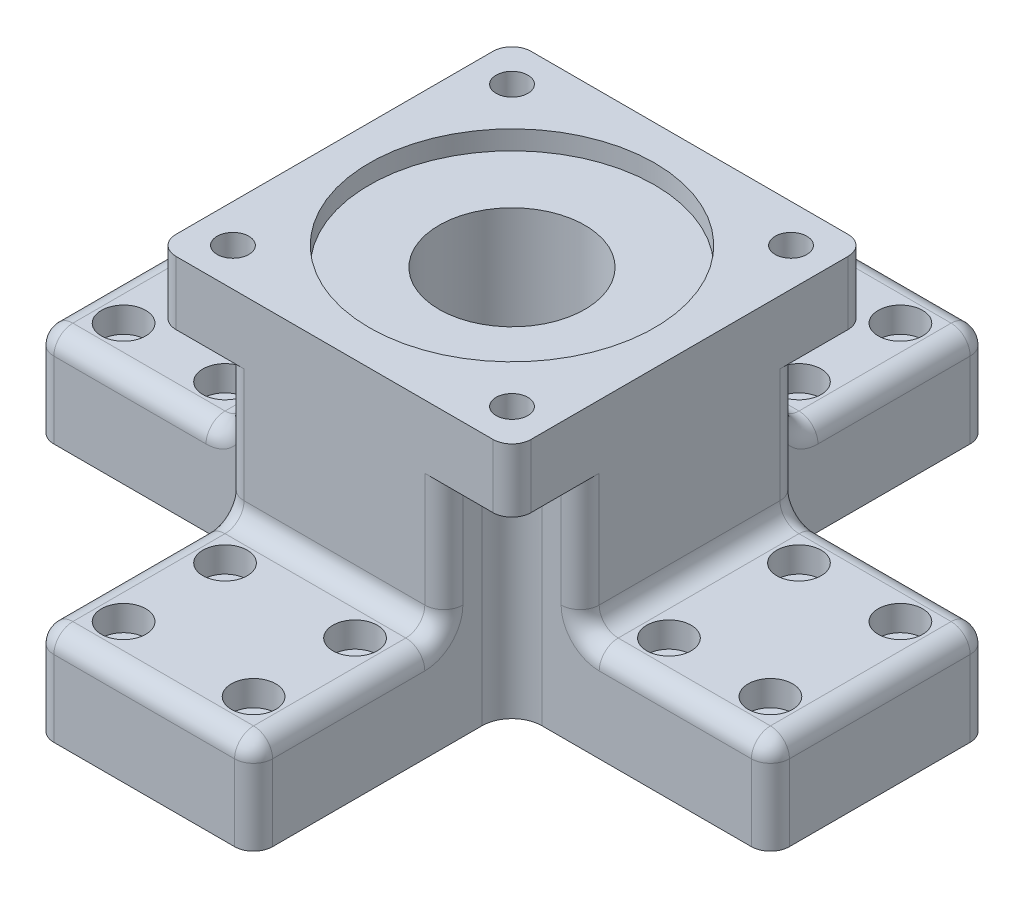
from build123d import *

# Parameters (mm, degrees)
SKETCH1_W           = 56
SKETCH1_H           = 56
BOSS_EXTRUDE1_DEPTH = 46
SKETCH2_R           = 22.5
CUT_EXTRUDE1_DEPTH  = 3
SKETCH3_R           = 11.5
CUT_EXTRUDE2_DEPTH  = 50
SKETCH4_R           = 2.5
CUT_EXTRUDE3_DEPTH  = 10
CUT_EXTRUDE4_DEPTH  = 36
SKETCH6_W           = 34.5
SKETCH6_H           = 15
BOSS_EXTRUDE2_DEPTH = 30
SKETCH7_R           = 2.15
CUT_EXTRUDE5_DEPTH  = 30
FILLET1_R           = 3
SKETCH8_R           = 3.5
CUT_EXTRUDE6_DEPTH  = 4
CIRPATTERN2_COUNT   = 4
FILLET2_R           = 3
FILLET3_R           = 3
FILLET4_R           = 3
FILLET5_R           = 3


with BuildPart() as part:
    # Sketch1 → Boss-Extrude1 (new body)
    with BuildSketch(Plane(origin=(0, 0, 0), x_dir=(1, 0, 0), z_dir=(0, 1, 0))):
        Rectangle(SKETCH1_W, SKETCH1_H)
    extrude(amount=BOSS_EXTRUDE1_DEPTH)

    # Sketch2 → Cut-Extrude1 (cut)
    with BuildSketch(Plane(origin=(0, 46, 0), x_dir=(1, 0, 0), z_dir=(0, 1, 0))):
        with Locations(Location((0, 0, 0), (0, 0, 270))):
            Circle(SKETCH2_R)
    extrude(amount=-CUT_EXTRUDE1_DEPTH, mode=Mode.SUBTRACT)

    # Sketch3 → Cut-Extrude2 (cut)
    with BuildSketch(Plane(origin=(0, 43, 0), x_dir=(1, 0, 0), z_dir=(0, 1, 0))):
        with Locations(Location((0, 0, 0), (0, 0, 270))):
            Circle(SKETCH3_R)
    extrude(amount=-CUT_EXTRUDE2_DEPTH, mode=Mode.SUBTRACT)

    # Sketch4 → Cut-Extrude3 (cut)
    with BuildSketch(Plane(origin=(0, 46, 0), x_dir=(1, 0, 0), z_dir=(0, 1, 0))):
        with Locations(Location((-22, 22, 0), (0, 0, 270))):
            Circle(SKETCH4_R)
        with Locations(Location((22, 22, 0), (0, 0, 90))):
            Circle(SKETCH4_R)
        with Locations(Location((22, -22, 0), (0, 0, 270))):
            Circle(SKETCH4_R)
        with Locations(Location((-22, -22, 0), (0, 0, 90))):
            Circle(SKETCH4_R)
    extrude(amount=-CUT_EXTRUDE3_DEPTH, mode=Mode.SUBTRACT)

    # Sketch5 → Cut-Extrude4 (cut)
    with BuildSketch(Plane.XZ):
        with BuildLine():
            Line((-22, 17.25), (-28, 17.25))
            Line((-28, 17.25), (-28, 28))
            Line((-28, 28), (-17.25, 28))
            Line((-17.25, 28), (-17.25, 22))
            ThreePointArc((-17.25, 22), (-18.641242789, 18.641242789), (-22, 17.25))
        make_face()
        with BuildLine():
            Line((17.25, 22), (17.25, 28))
            Line((17.25, 28), (28, 28))
            Line((28, 28), (28, 17.25))
            Line((28, 17.25), (22, 17.25))
            ThreePointArc((22, 17.25), (18.641242789, 18.641242789), (17.25, 22))
        make_face()
        with BuildLine():
            Line((-28, -17.25), (-28, -28))
            Line((-28, -28), (-17.25, -28))
            Line((-17.25, -28), (-17.25, -22))
            ThreePointArc((-17.25, -22), (-18.641242789, -18.641242789), (-22, -17.25))
            Line((-22, -17.25), (-28, -17.25))
        make_face()
        with BuildLine():
            Line((22, -17.25), (28, -17.25))
            Line((28, -17.25), (28, -28))
            Line((28, -28), (17.25, -28))
            Line((17.25, -28), (17.25, -22))
            ThreePointArc((17.25, -22), (18.641242789, -18.641242789), (22, -17.25))
        make_face()
    extrude(amount=-CUT_EXTRUDE4_DEPTH, mode=Mode.SUBTRACT)

    # Sketch6 → Boss-Extrude2 (add)
    with BuildSketch(Plane(origin=(0, 0, -28), x_dir=(-1, 0, 0), z_dir=(0, 0, -1))):
        with Locations((0, 7.5)):
            Rectangle(SKETCH6_W, SKETCH6_H)
    boss_extrude2 = extrude(amount=BOSS_EXTRUDE2_DEPTH)

    # Sketch7 → Cut-Extrude5 (cut)
    with BuildSketch(Plane(origin=(0, 15, 0), x_dir=(1, 0, 0), z_dir=(0, 1, 0))):
        with Locations(Location((-10.25, 51, 0), (0, 0, 270))):
            Circle(SKETCH7_R)
        with Locations(Location((10.25, 51, 0), (0, 0, 90))):
            Circle(SKETCH7_R)
        with Locations(Location((10.25, 35, 0), (0, 0, 270))):
            Circle(SKETCH7_R)
        with Locations(Location((-10.25, 35, 0), (0, 0, 90))):
            Circle(SKETCH7_R)
    cut_extrude5 = extrude(amount=-CUT_EXTRUDE5_DEPTH, mode=Mode.SUBTRACT)

    # Fillet1
    fillet1_edges = [part.edges().sort_by_distance(p)[0] for p in [
        (0, 15, -28),
    ]]
    fillet(fillet1_edges, radius=FILLET1_R)

    # Sketch8 → Cut-Extrude6 (cut)
    with BuildSketch(Plane(origin=(0, 15, 0), x_dir=(1, 0, 0), z_dir=(0, 1, 0))):
        with Locations(Location((-10.25, 51, 0), (0, 0, 270))):
            Circle(SKETCH8_R)
        with Locations(Location((10.25, 51, 0), (0, 0, 270))):
            Circle(SKETCH8_R)
        with Locations(Location((-10.25, 35, 0), (0, 0, 270))):
            Circle(SKETCH8_R)
        with Locations(Location((10.25, 35, 0), (0, 0, 270))):
            Circle(SKETCH8_R)
    cut_extrude6 = extrude(amount=-CUT_EXTRUDE6_DEPTH, mode=Mode.SUBTRACT)

    # CirPattern2: Boss-Extrude2, Cut-Extrude5, Cut-Extrude6 ×4 about axis
    cirpattern2_axis = Axis((0, 0, 0), (0, 1, 0))
    add([boss_extrude2.rotate(cirpattern2_axis, i * 360 / CIRPATTERN2_COUNT) for i in range(1, CIRPATTERN2_COUNT)])
    add([cut_extrude5.rotate(cirpattern2_axis, i * 360 / CIRPATTERN2_COUNT) for i in range(1, CIRPATTERN2_COUNT)], mode=Mode.SUBTRACT)
    add([cut_extrude6.rotate(cirpattern2_axis, i * 360 / CIRPATTERN2_COUNT) for i in range(1, CIRPATTERN2_COUNT)], mode=Mode.SUBTRACT)

    # Fillet2
    fillet2_edges = [part.edges().sort_by_distance(p)[0] for p in [
        (-28, 15, 0),
        (0, 15, 28),
        (28, 15, 0),
    ]]
    fillet(fillet2_edges, radius=FILLET2_R)

    # Fillet3
    fillet3_edges = [part.edges().sort_by_distance(p)[0] for p in [
        (17.25, 7.5, -58),
        (-17.25, 7.5, -58),
        (-58, 7.5, -17.25),
        (-58, 7.5, 17.25),
        (-17.25, 7.5, 58),
        (17.25, 7.5, 58),
        (58, 7.5, 17.25),
        (58, 7.5, -17.25),
    ]]
    fillet(fillet3_edges, radius=FILLET3_R)

    # Fillet4
    fillet4_edges = [part.edges().sort_by_distance(p)[0] for p in [
        (17.25, 15.878679656, -28.878679656),
        (-17.25, 15.878679656, -28.878679656),
        (28.878679656, 15.878679656, 17.25),
        (28.878679656, 15.878679656, -17.25),
        (-28.878679656, 15.878679656, -17.25),
        (-28.878679656, 15.878679656, 17.25),
        (0, 15, -58),
        (17.25, 15, -43),
        (-17.25, 15, -43),
        (-16.371320344, 15, -57.121320344),
        (16.371320344, 15, -57.121320344),
        (58, 15, 0),
        (43, 15, -17.25),
        (43, 15, 17.25),
        (57.121320344, 15, 16.371320344),
        (57.121320344, 15, -16.371320344),
        (-58, 15, 0),
        (-43, 15, 17.25),
        (-43, 15, -17.25),
        (-57.121320344, 15, -16.371320344),
        (-57.121320344, 15, 16.371320344),
        (28, 27, 17.25),
        (-28, 27, -17.25),
        (-17.25, 27, -28),
        (28, 27, -17.25),
        (17.25, 27, -28),
        (28, 41, 28),
        (-28, 41, 28),
        (-28, 41, -28),
        (28, 41, -28),
        (-28, 27, 17.25),
    ]]
    fillet(fillet4_edges, radius=FILLET4_R)

    # Fillet5
    fillet5_edges = [part.edges().sort_by_distance(p)[0] for p in [
        (-17.25, 15.878679656, 28.878679656),
        (17.25, 15.878679656, 28.878679656),
        (0, 15, 58),
        (17.25, 15, 43),
        (-17.25, 15, 43),
        (-16.371320344, 15, 57.121320344),
        (16.371320344, 15, 57.121320344),
        (17.25, 27, 28),
        (-17.25, 27, 28),
    ]]
    fillet(fillet5_edges, radius=FILLET5_R)


solid = part.part
